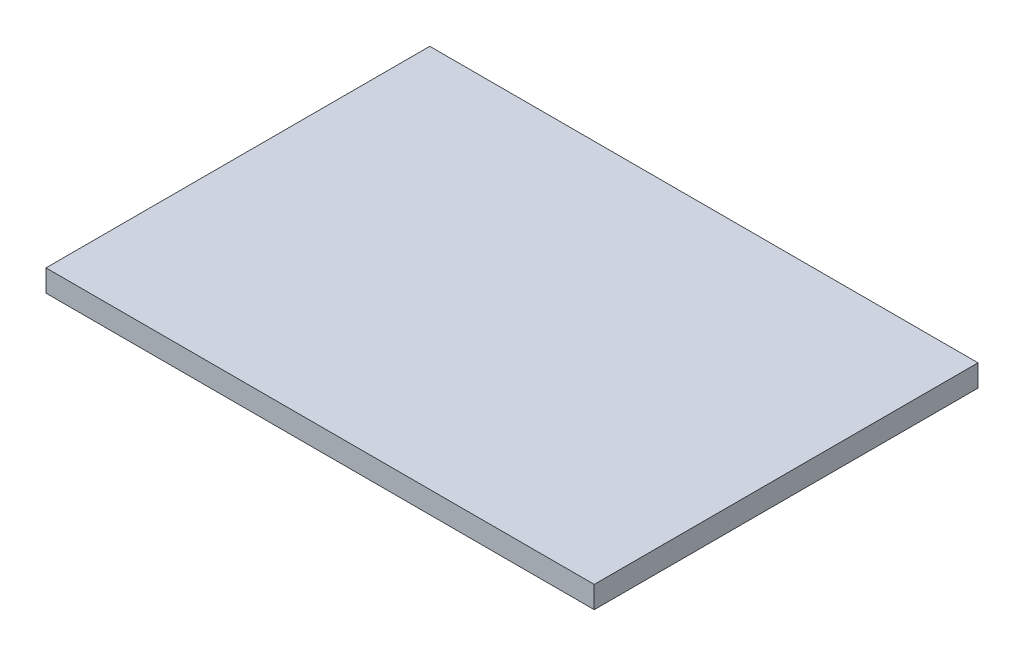
from build123d import *

# Parameters (mm, degrees)
SKETCH1_W           = 27.94
SKETCH1_H           = 27.94
BOSS_EXTRUDE1_DEPTH = 127
CUT_EXTRUDE1_REACH  = 130.528
SKETCH2_W           = 22.86
SKETCH2_H           = 22.86
SKETCH3_W           = 50.8
SKETCH3_H           = 177.8
BOSS_EXTRUDE2_DEPTH = 10.16
CUT_EXTRUDE2_REACH  = 221.622
SKETCH4_R           = 6.35
SKETCH5_W           = 177.8
SKETCH5_H           = 10.16
BOSS_EXTRUDE3_DEPTH = 203.2
SKETCH7_R           = 7.5
CUT_EXTRUDE4_DEPTH  = 5.08


with BuildPart() as part:
    # Sketch1 → Boss-Extrude1 (new body)
    with BuildSketch(Plane(origin=(0, 0, 0), x_dir=(1, 0, 0), z_dir=(0, 1, 0))):
        Rectangle(SKETCH1_W, SKETCH1_H)
    extrude(amount=BOSS_EXTRUDE1_DEPTH)

    # Sketch2 → Cut-Extrude1 (cut, up to next)
    with BuildSketch(Plane(origin=(0, 127, 0), x_dir=(1, 0, 0), z_dir=(0, 1, 0)), mode=Mode.PRIVATE) as cut_extrude1_sk1:
        Rectangle(SKETCH2_W, SKETCH2_H)
    cut_extrude1_tool1 = extrude(cut_extrude1_sk1.sketch, amount=-CUT_EXTRUDE1_REACH, mode=Mode.PRIVATE) & part.part
    add(cut_extrude1_tool1.solids().sort_by_distance((0, 127, 0))[0], mode=Mode.SUBTRACT)

    # Sketch3 → Boss-Extrude2 (add)
    with BuildSketch(Plane(origin=(0, 127, 0), x_dir=(1, 0, 0), z_dir=(0, 1, 0))):
        with Locations((-11.43, -74.93)):
            Rectangle(SKETCH3_W, SKETCH3_H)
    extrude(amount=BOSS_EXTRUDE2_DEPTH)

    # Sketch4 → Cut-Extrude2 (cut, up to next)
    with BuildSketch(Plane(origin=(13.97, 0, 0), x_dir=(0, 0, -1), z_dir=(1, 0, 0)), mode=Mode.PRIVATE) as cut_extrude2_sk1:
        with Locations((0, 25.4)):
            Circle(SKETCH4_R)
    cut_extrude2_tool1 = extrude(cut_extrude2_sk1.sketch, amount=-CUT_EXTRUDE2_REACH, mode=Mode.PRIVATE) & part.part
    # Sketch4 → Cut-Extrude2 (cut, up to next)
    with BuildSketch(Plane(origin=(13.97, 0, 0), x_dir=(0, 0, -1), z_dir=(1, 0, 0)), mode=Mode.PRIVATE) as cut_extrude2_sk2:
        with Locations((0, 43.18)):
            Circle(SKETCH4_R)
    cut_extrude2_tool2 = extrude(cut_extrude2_sk2.sketch, amount=-CUT_EXTRUDE2_REACH, mode=Mode.PRIVATE) & part.part
    # Sketch4 → Cut-Extrude2 (cut, up to next)
    with BuildSketch(Plane(origin=(13.97, 0, 0), x_dir=(0, 0, -1), z_dir=(1, 0, 0)), mode=Mode.PRIVATE) as cut_extrude2_sk3:
        with Locations((0, 60.96)):
            Circle(SKETCH4_R)
    cut_extrude2_tool3 = extrude(cut_extrude2_sk3.sketch, amount=-CUT_EXTRUDE2_REACH, mode=Mode.PRIVATE) & part.part
    # Sketch4 → Cut-Extrude2 (cut, up to next)
    with BuildSketch(Plane(origin=(13.97, 0, 0), x_dir=(0, 0, -1), z_dir=(1, 0, 0)), mode=Mode.PRIVATE) as cut_extrude2_sk4:
        with Locations((0, 78.74)):
            Circle(SKETCH4_R)
    cut_extrude2_tool4 = extrude(cut_extrude2_sk4.sketch, amount=-CUT_EXTRUDE2_REACH, mode=Mode.PRIVATE) & part.part
    # Sketch4 → Cut-Extrude2 (cut, up to next)
    with BuildSketch(Plane(origin=(13.97, 0, 0), x_dir=(0, 0, -1), z_dir=(1, 0, 0)), mode=Mode.PRIVATE) as cut_extrude2_sk5:
        with Locations((0, 96.52)):
            Circle(SKETCH4_R)
    cut_extrude2_tool5 = extrude(cut_extrude2_sk5.sketch, amount=-CUT_EXTRUDE2_REACH, mode=Mode.PRIVATE) & part.part
    add(cut_extrude2_tool1.solids().sort_by_distance((13.97, 25.4, 0))[0], mode=Mode.SUBTRACT)
    add(cut_extrude2_tool2.solids().sort_by_distance((13.97, 43.18, 0))[0], mode=Mode.SUBTRACT)
    add(cut_extrude2_tool3.solids().sort_by_distance((13.97, 60.96, 0))[0], mode=Mode.SUBTRACT)
    add(cut_extrude2_tool4.solids().sort_by_distance((13.97, 78.74, 0))[0], mode=Mode.SUBTRACT)
    add(cut_extrude2_tool5.solids().sort_by_distance((13.97, 96.52, 0))[0], mode=Mode.SUBTRACT)

    # Sketch5 → Boss-Extrude3 (add)
    with BuildSketch(Plane(origin=(13.97, 0, 0), x_dir=(0, 0, -1), z_dir=(1, 0, 0))):
        with Locations((-74.93, 132.08)):
            Rectangle(SKETCH5_W, SKETCH5_H)
    extrude(amount=BOSS_EXTRUDE3_DEPTH)

    # Sketch7 → Cut-Extrude4 (cut)
    with BuildSketch(Plane.XZ.offset(-127)):
        with Locations(Location((90.17, 43.501665218, 0), (0, 0, 270))):
            Circle(SKETCH7_R)
    extrude(amount=-CUT_EXTRUDE4_DEPTH, mode=Mode.SUBTRACT)


solid = part.part
